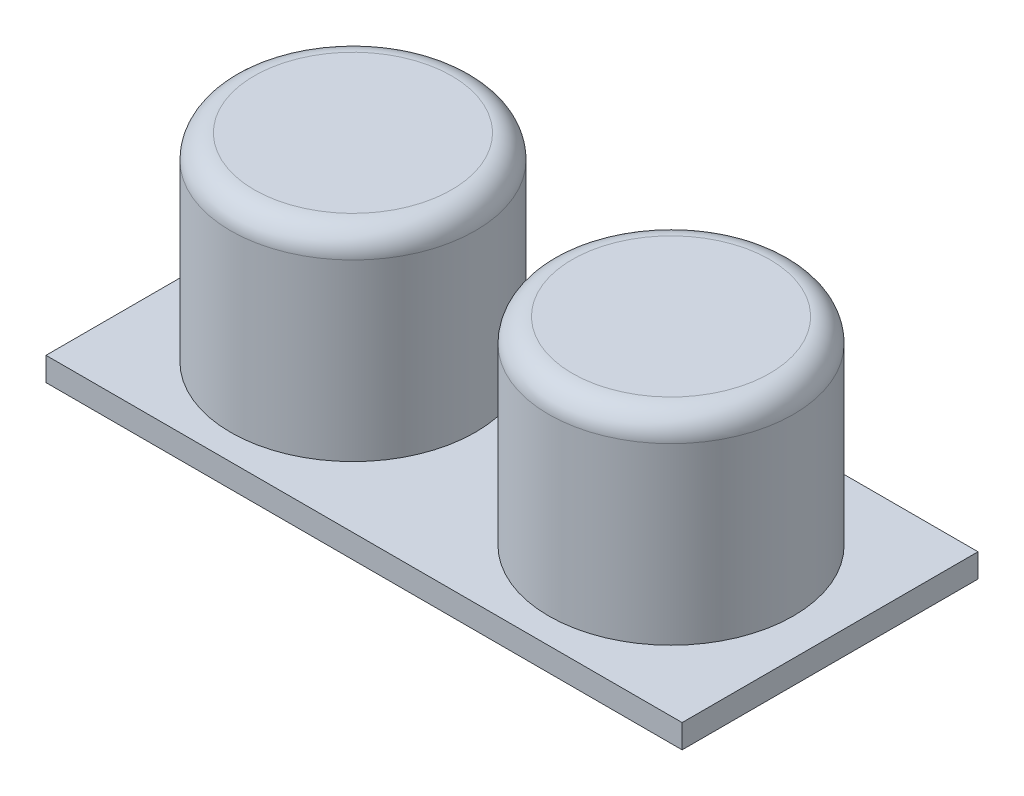
from build123d import *

# Parameters (mm, degrees)
SKETCH_1_W      = 43
SKETCH_1_H      = 20
EXTRUDE_1_DEPTH = 1.6
SKETCH_2_R      = 8.272930051
EXTRUDE_2_DEPTH = 13.4
FILLET_1_R      = 1.6
SKETCH_9_W      = 10.16
SKETCH_9_H      = 2.54
EXTRUDE_3_DEPTH = 1.6


with BuildPart() as part:
    # 스케치1 → 보스-돌출1 (new body)
    with BuildSketch(Plane(origin=(0, 0, 0), x_dir=(1, 0, 0), z_dir=(0, 1, 0))):
        Rectangle(SKETCH_1_W, SKETCH_1_H)
    extrude(amount=EXTRUDE_1_DEPTH)

    # 스케치2 → 보스-돌출2 (add)
    with BuildSketch(Plane(origin=(0, 1.6, 0), x_dir=(1, 0, 0), z_dir=(0, 1, 0))):
        with Locations(Location((-10.75, 0, 0), (0, 0, 90))):
            Circle(SKETCH_2_R)
        with Locations(Location((10.75, 0, 0), (0, 0, 90))):
            Circle(SKETCH_2_R)
    extrude(amount=EXTRUDE_2_DEPTH)

    # 필렛1
    fillet_1_edges = [part.edges().sort_by_distance(p)[0] for p in [
        (-10.75, 15, 8.272930051),
        (10.75, 15, 8.272930051),
    ]]
    fillet(fillet_1_edges, radius=FILLET_1_R)

    # 스케치9 → 보스-돌출3 (add)
    with BuildSketch(Plane.XZ):
        with Locations((-1.27, -8.59488099)):
            Rectangle(SKETCH_9_W, SKETCH_9_H)
    extrude(amount=EXTRUDE_3_DEPTH)


solid = part.part
